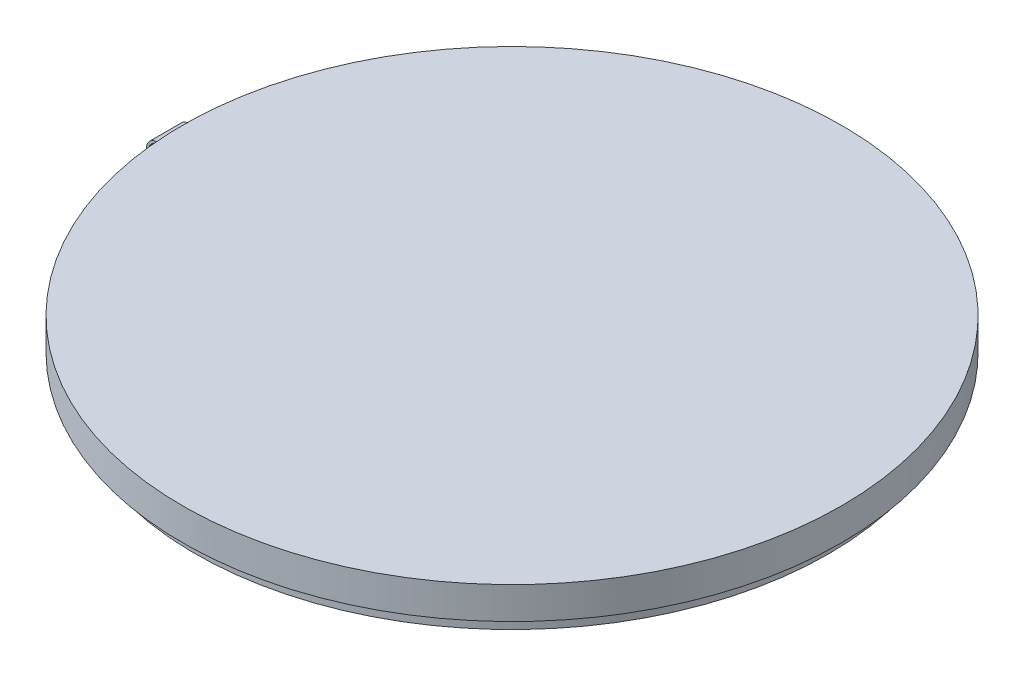
from build123d import *

# Parameters (mm, degrees)
SKETCH3_R           = 0.635
BOSS_EXTRUDE1_DEPTH = 1.27


with BuildPart() as part:
    # Sketch2 → Revolve1 (revolve)
    with BuildSketch(Plane.XY):
        Polygon((0, 0), (0, 2.54), (26.162, 2.54), (26.162, 0), (25.146, 0), (25.146, -1.27), (24.13, -1.27), (24.13, 0), align=None)
    revolve(axis=Axis((0, -1000, 0), (0, 1, 0)))

    # Sketch3 → Boss-Extrude1 (add, symmetric)
    with BuildSketch(Plane.XY):
        with BuildLine():
            Line((-25.4, 1.651), (-25.4, 0))
            Line((-25.4, 0), (-26.924, 0))
            ThreePointArc((-26.924, 0), (-27.7495, 0.8255), (-26.924, 1.651))
            Line((-26.924, 1.651), (-25.4, 1.651))
        make_face()
        with Locations((-26.924, 0.8255)):
            Circle(SKETCH3_R, mode=Mode.SUBTRACT)
    extrude(amount=BOSS_EXTRUDE1_DEPTH, both=True)


solid = part.part
